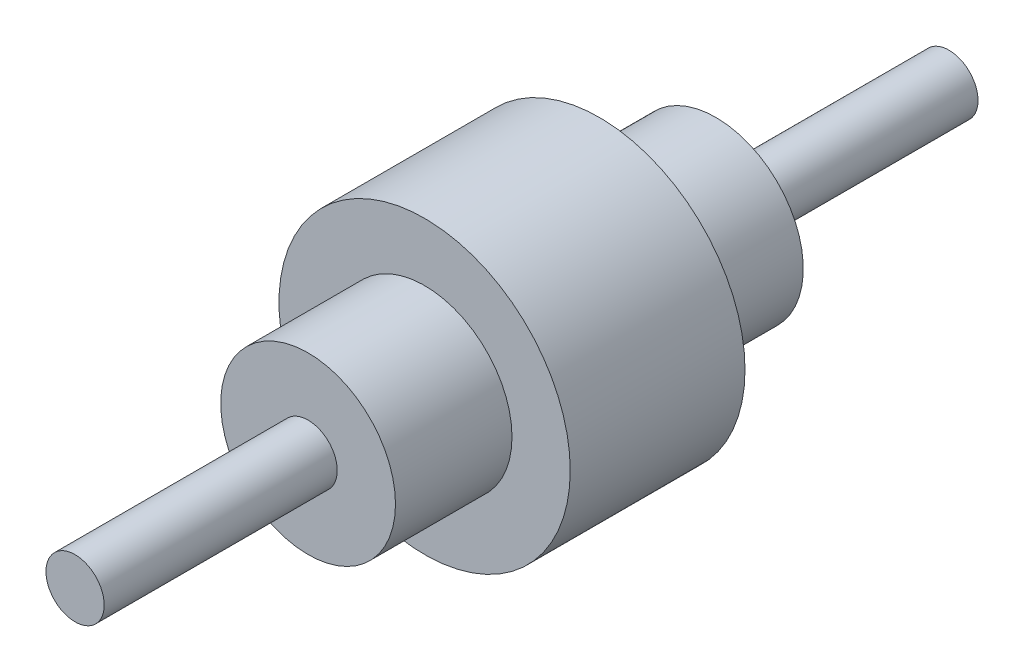
from build123d import *

# Parameters (mm, degrees)
SKETCH1_R           = 1270
BOSS_EXTRUDE1_DEPTH = 1524
SKETCH2_R           = 762
BOSS_EXTRUDE2_DEPTH = 1016
SKETCH3_R           = 254
BOSS_EXTRUDE3_DEPTH = 2032
BOSS_EXTRUDE4_START = 1016
SKETCH4_R           = 762
BOSS_EXTRUDE4_DEPTH = 1016
BOSS_EXTRUDE5_START = 2032
SKETCH5_R           = 254
BOSS_EXTRUDE5_DEPTH = 2032


with BuildPart() as part:
    # Sketch1 → Boss-Extrude1 (new body)
    with BuildSketch(Plane.XY):
        Circle(SKETCH1_R)
    extrude(amount=BOSS_EXTRUDE1_DEPTH)

    # Sketch2 → Boss-Extrude2 (add)
    with BuildSketch(Plane.XY.offset(1524)):
        Circle(SKETCH2_R)
    extrude(amount=BOSS_EXTRUDE2_DEPTH)

    # Sketch3 → Boss-Extrude3 (add)
    with BuildSketch(Plane.XY.offset(2540)):
        Circle(SKETCH3_R)
    extrude(amount=BOSS_EXTRUDE3_DEPTH)

    # Sketch4 → Boss-Extrude4 (add)
    with BuildSketch(Plane(origin=(0, 0, 0), x_dir=(-1, 0, 0), z_dir=(0, 0, -1)).offset(BOSS_EXTRUDE4_START)):
        with Locations(Location((0, 0, 0), (0, 0, 180))):
            Circle(SKETCH4_R)
    extrude(amount=-BOSS_EXTRUDE4_DEPTH)

    # Sketch5 → Boss-Extrude5 (add)
    with BuildSketch(Plane(origin=(0, 0, -1016), x_dir=(-1, 0, 0), z_dir=(0, 0, -1)).offset(BOSS_EXTRUDE5_START)):
        with Locations(Location((0, 0, 0), (0, 0, 180))):
            Circle(SKETCH5_R)
    extrude(amount=-BOSS_EXTRUDE5_DEPTH)


solid = part.part
